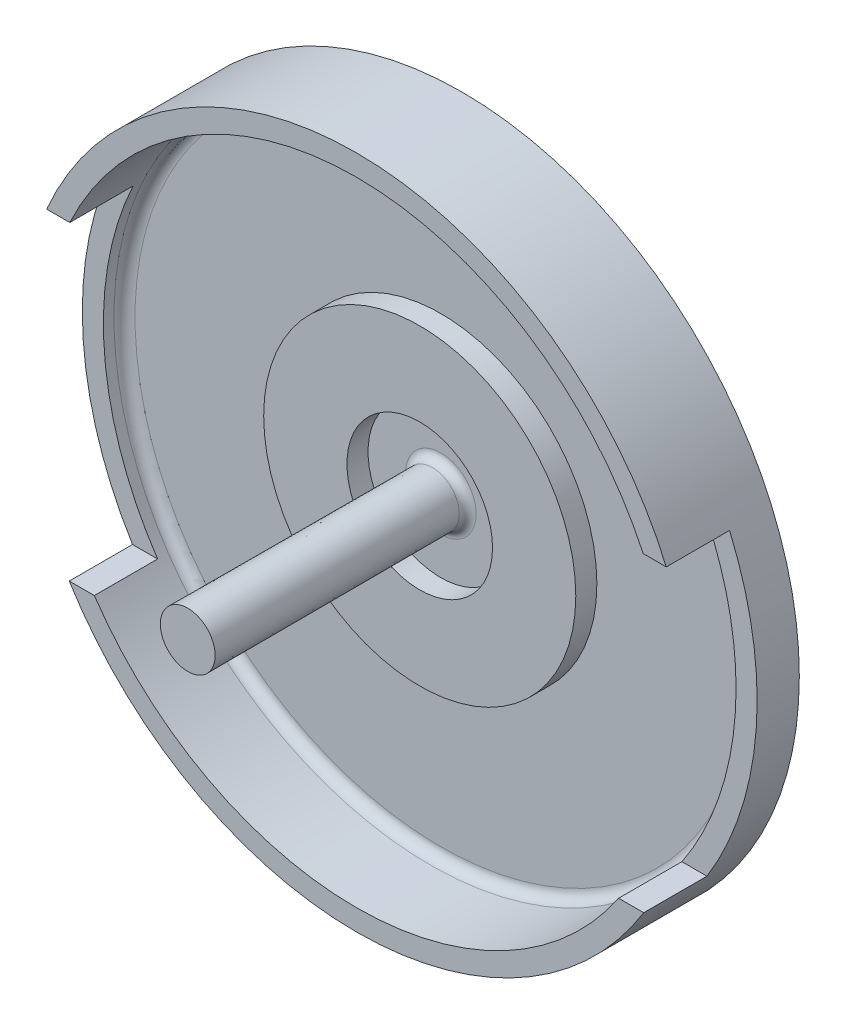
from build123d import *

# Parameters (mm, degrees)
SKETCH1_R           = 16
BOSS_EXTRUDE1_DEPTH = 5
SKETCH3_R           = 15
CUT_EXTRUDE1_DEPTH  = 4
FILLET1_R           = 0.5
SKETCH7_W           = 5.268501054
SKETCH7_H           = 14.735182388
CUT_EXTRUDE2_DEPTH  = 11
SKETCH8_R           = 7.4
BOSS_EXTRUDE2_DEPTH = 1
SKETCH9_R           = 3.45
CUT_EXTRUDE3_DEPTH  = 1
SKETCH5_R           = 1.275
SKETCH6_R           = 1.3
FILLET3_R           = 0.4


with BuildPart() as part:
    # Sketch1 → Boss-Extrude1 (new body)
    with BuildSketch(Plane.XY):
        Circle(SKETCH1_R)
    extrude(amount=BOSS_EXTRUDE1_DEPTH)

    # Sketch3 → Cut-Extrude1 (cut)
    with BuildSketch(Plane.XY.offset(5)):
        Circle(SKETCH3_R)
    extrude(amount=-CUT_EXTRUDE1_DEPTH, mode=Mode.SUBTRACT)

    # Fillet1
    fillet1_edges = [part.edges().sort_by_distance(p)[0] for p in [
        (-15, 0, 1),
    ]]
    fillet(fillet1_edges, radius=FILLET1_R)

    # Sketch7 → Cut-Extrude2 (cut)
    with BuildSketch(Plane.XY.offset(13)):
        with Locations((-14.456252894, -1.028256592)):
            Rectangle(SKETCH7_W, SKETCH7_H)
    cut_extrude2 = extrude(amount=-CUT_EXTRUDE2_DEPTH, mode=Mode.SUBTRACT)

    # Mirror1: Cut-Extrude2 across plane
    add(cut_extrude2.mirror(Plane(origin=(0, 0, 0), x_dir=(0, 0, 1), z_dir=(1, 0, 0))), mode=Mode.SUBTRACT)

    # Sketch8 → Boss-Extrude2 (add)
    with BuildSketch(Plane.XY.offset(1)):
        Circle(SKETCH8_R)
    extrude(amount=BOSS_EXTRUDE2_DEPTH)

    # Sketch9 → Cut-Extrude3 (cut)
    with BuildSketch(Plane.XY.offset(2)):
        Circle(SKETCH9_R)
    extrude(amount=-CUT_EXTRUDE3_DEPTH, mode=Mode.SUBTRACT)

    # Sketch5 → Loft1 section 0
    with BuildSketch(Plane.XY.offset(1)):
        Circle(SKETCH5_R)
    # Sketch6 → Loft1 section 1
    with BuildSketch(Plane.XY.offset(13)):
        Circle(SKETCH6_R)
    loft()

    # Fillet3
    fillet3_edges = [part.edges().sort_by_distance(p)[0] for p in [
        (-1.275, 0, 1),
    ]]
    fillet(fillet3_edges, radius=FILLET3_R)


solid = part.part
